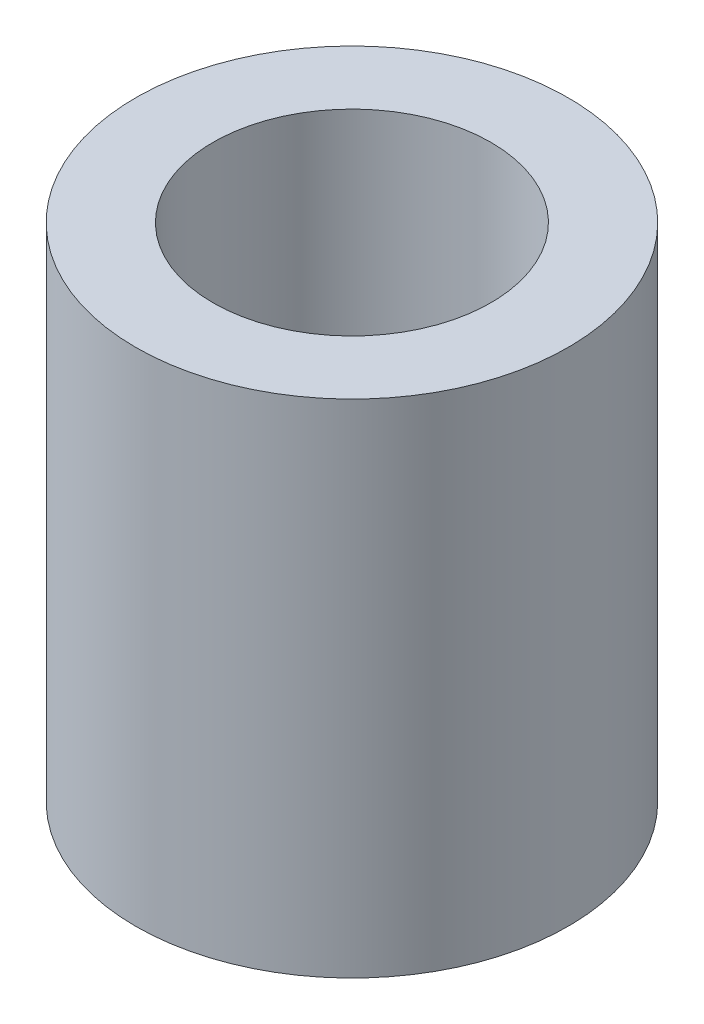
from build123d import *

# Parameters (mm, degrees)
SKETCH1_R           = 6.9
BOSS_EXTRUDE1_DEPTH = 16
SKETCH2_R           = 4.435
CUT_EXTRUDE1_DEPTH  = 14


with BuildPart() as part:
    # Sketch1 → Boss-Extrude1 (new body)
    with BuildSketch(Plane(origin=(0, 0, 0), x_dir=(1, 0, 0), z_dir=(0, 1, 0))):
        with Locations(Location((0, 0, 0), (0, 0, 270))):
            Circle(SKETCH1_R)
    extrude(amount=BOSS_EXTRUDE1_DEPTH)

    # Sketch2 → Cut-Extrude1 (cut)
    with BuildSketch(Plane(origin=(0, 16, 0), x_dir=(1, 0, 0), z_dir=(0, 1, 0))):
        with Locations(Location((0, 0, 0), (0, 0, 270))):
            Circle(SKETCH2_R)
    extrude(amount=-CUT_EXTRUDE1_DEPTH, mode=Mode.SUBTRACT)


solid = part.part
